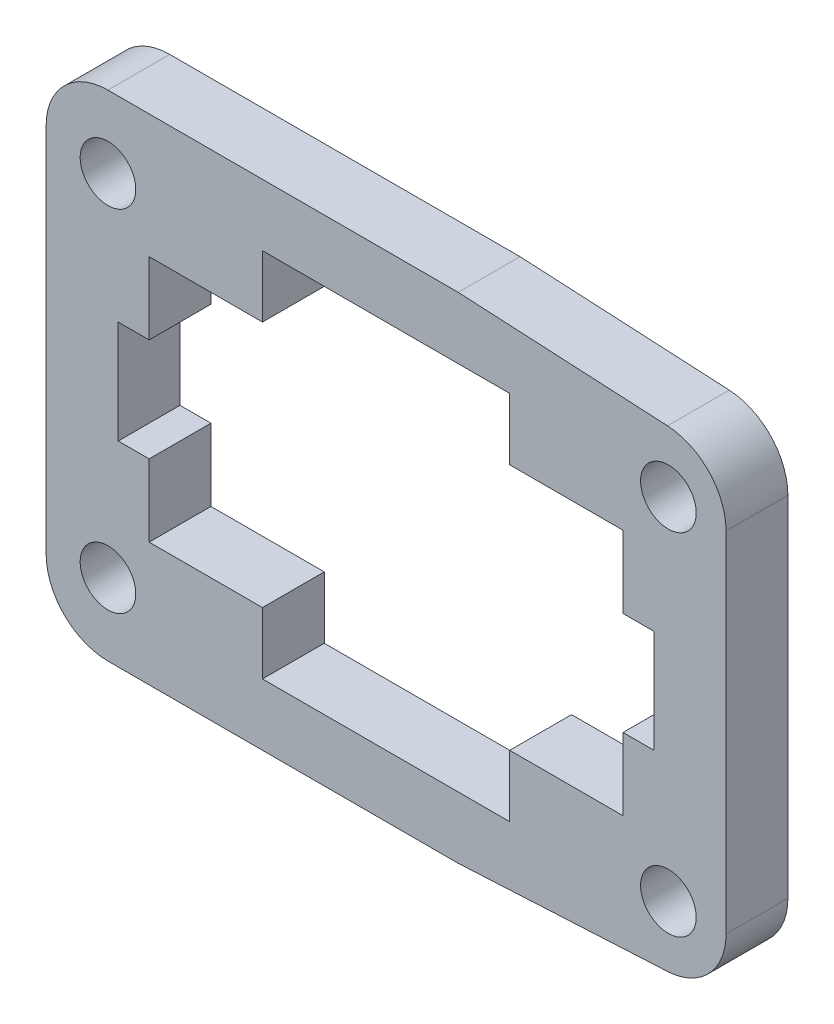
from build123d import *

# Parameters (mm, degrees)
SKETCH_1_R      = 1.35
EXTRUDE_1_DEPTH = 3


with BuildPart() as part:
    # 草图1 → 凸台-拉伸1 (new body)
    with BuildSketch(Plane.XY.offset(3)):
        with BuildLine():
            Line((-6.157118156, 20.9998), (-6.157118156, 3))
            ThreePointArc((-6.157118156, 3), (-5.2784385, 0.878679656), (-3.157118156, 0))
            Line((-3.157118156, 0), (13.843681844, 0))
            Line((13.843681844, 0), (24.001386189, 0.533010723))
            ThreePointArc((24.001386189, 0.533010723), (26.020372671, 1.463896655), (26.844181844, 3.528889024))
            Line((26.844181844, 3.528889024), (26.844181844, 20.471910982))
            ThreePointArc((26.844181844, 20.471910982), (26.020271299, 22.537010177), (24.001092054, 23.467804703))
            Line((24.001092054, 23.467804703), (13.843681844, 23.9998))
            Line((13.843681844, 23.9998), (-3.157118156, 23.9998))
            ThreePointArc((-3.157118156, 23.9998), (-5.2784385, 23.121120344), (-6.157118156, 20.9998))
        make_face()
        with Locations(Location((-3.156018156, 20.498351651, 0), (0, 0, 180))):
            Circle(SKETCH_1_R, mode=Mode.SUBTRACT)
        with Locations(Location((24.044031844, 20.498351651, 0), (0, 0, 180))):
            Circle(SKETCH_1_R, mode=Mode.SUBTRACT)
        with Locations(Location((-3.156018156, 3.501148349, 0), (0, 0, 180))):
            Circle(SKETCH_1_R, mode=Mode.SUBTRACT)
        with Locations(Location((24.044031844, 3.501148349, 0), (0, 0, 180))):
            Circle(SKETCH_1_R, mode=Mode.SUBTRACT)
        Polygon((23.343481844, 9.5), (21.843181844, 9.5), (21.843181844, 6), (16.343381844, 6), (16.343381844, 3), (4.343381844, 3), (4.343381844, 6), (-1.156518156, 6), (-1.156518156, 9.5), (-2.656818156, 9.5), (-2.656818156, 14.4995), (-1.156518156, 14.4995), (-1.156518156, 17.9998), (4.343381844, 17.9998), (4.343381844, 20.9998), (16.343381844, 20.9998), (16.343381844, 17.9998), (21.843181844, 17.9998), (21.843181844, 14.4995), (23.343481844, 14.4995), align=None, mode=Mode.SUBTRACT)
    extrude(amount=-EXTRUDE_1_DEPTH)


solid = part.part
